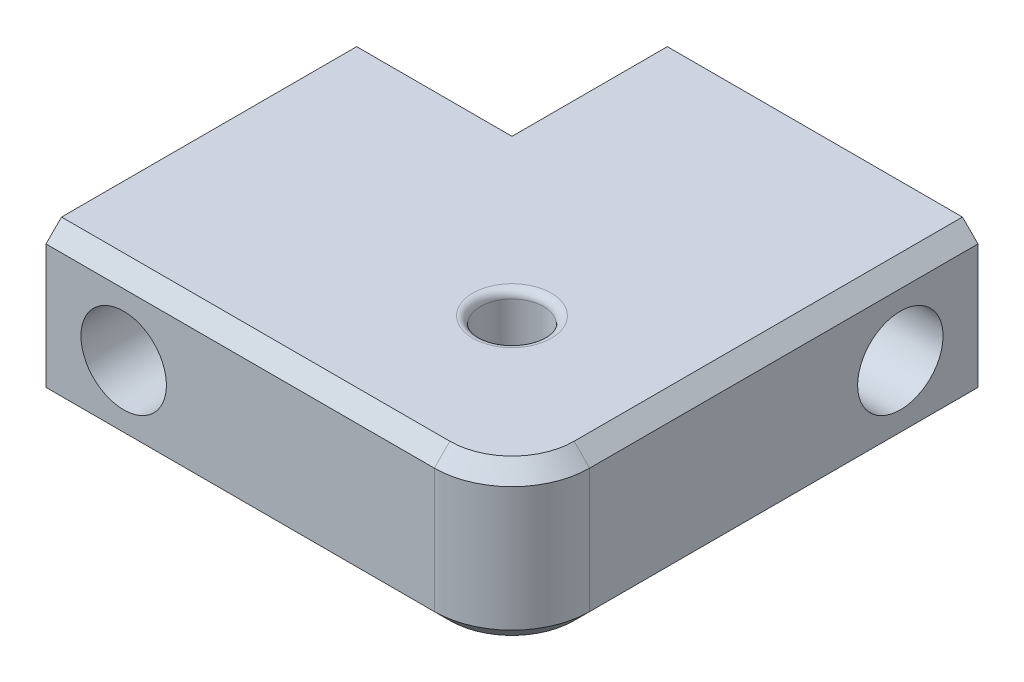
from build123d import *

# Parameters (mm, degrees)
SKETCH1_R           = 4.05
BOSS_EXTRUDE1_DEPTH = 20
FILLET1_R           = 1
CHAMFER2_SIZE       = 2
SKETCH7_R           = 2.65
CUT_EXTRUDE8_DEPTH  = 40
SKETCH8_R           = 2.65
CUT_EXTRUDE9_DEPTH  = 40
SKETCH9_R           = 5.5
CUT_EXTRUDE10_DEPTH = 40
SKETCH10_R          = 5.5
CUT_EXTRUDE11_DEPTH = 40


with BuildPart() as part:
    # Sketch1 → Boss-Extrude1 (new body)
    with BuildSketch(Plane(origin=(0, 0, 0), x_dir=(1, 0, 0), z_dir=(0, 1, 0))):
        with BuildLine():
            Line((-20, 40), (20, 40))
            Line((20, 40), (20, -10))
            ThreePointArc((20, -10), (17.071067812, -17.071067812), (10, -20))
            Line((10, -20), (-40, -20))
            Line((-40, -20), (-40, 20))
            Line((-40, 20), (-20, 20))
            Line((-20, 20), (-20, 40))
        make_face()
        with Locations(Location((0, 0, 0), (0, 0, 270))):
            Circle(SKETCH1_R, mode=Mode.SUBTRACT)
    extrude(amount=BOSS_EXTRUDE1_DEPTH)

    # Fillet1
    fillet1_edges = [part.edges().sort_by_distance(p)[0] for p in [
        (0, 20, -4.05),
    ]]
    fillet(fillet1_edges, radius=FILLET1_R)

    # Chamfer2
    chamfer2_edges = [part.edges().sort_by_distance(p)[0] for p in [
        (-15, 20, 20),
        (17.071067812, 20, 17.071067812),
        (20, 20, -15),
        (20, 0, -15),
        (17.071067812, 0, 17.071067812),
        (-15, 0, 20),
    ]]
    chamfer(chamfer2_edges, length=CHAMFER2_SIZE)

    # Sketch7 → Cut-Extrude8 (cut)
    with BuildSketch(Plane.ZY.offset(20)):
        with Locations((-30, 10)):
            Circle(SKETCH7_R)
    extrude(amount=-CUT_EXTRUDE8_DEPTH, mode=Mode.SUBTRACT)

    # Sketch8 → Cut-Extrude9 (cut)
    with BuildSketch(Plane(origin=(0, 0, -20), x_dir=(-1, 0, 0), z_dir=(0, 0, -1))):
        with Locations((30, 10)):
            Circle(SKETCH8_R)
    extrude(amount=-CUT_EXTRUDE9_DEPTH, mode=Mode.SUBTRACT)

    # Sketch9 → Cut-Extrude10 (cut)
    with BuildSketch(Plane.ZY.offset(9)):
        with Locations((-30, 10)):
            Circle(SKETCH9_R)
    extrude(amount=-CUT_EXTRUDE10_DEPTH, mode=Mode.SUBTRACT)

    # Sketch10 → Cut-Extrude11 (cut)
    with BuildSketch(Plane(origin=(0, 0, -9), x_dir=(-1, 0, 0), z_dir=(0, 0, -1))):
        with Locations((30, 10)):
            Circle(SKETCH10_R)
    extrude(amount=-CUT_EXTRUDE11_DEPTH, mode=Mode.SUBTRACT)


solid = part.part
